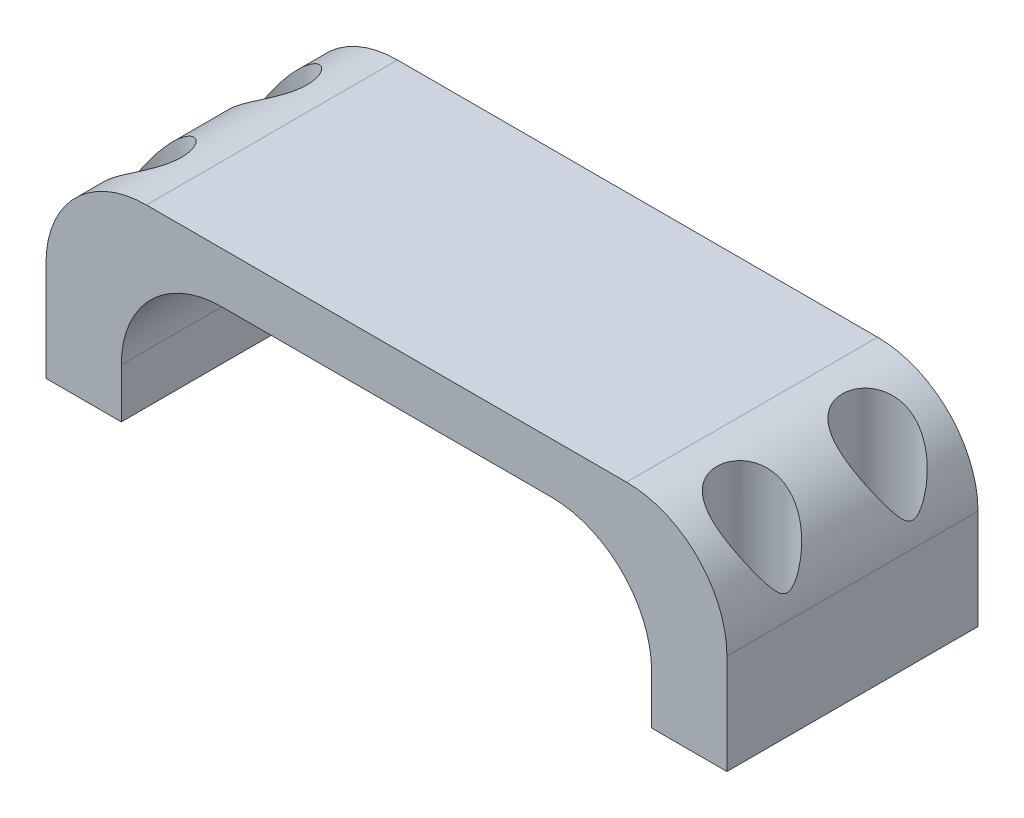
from build123d import *

# Parameters (mm, degrees)
BOSS_EXTRUDE1_DEPTH = 31.75
SKETCH2_R           = 3.175
CUT_EXTRUDE1_DEPTH  = 37.084
SKETCH3_R           = 4.445
CUT_EXTRUDE2_DEPTH  = 37.084


with BuildPart() as part:
    # Sketch1 → Boss-Extrude1 (new body)
    with BuildSketch(Plane.XY):
        with BuildLine():
            Line((-58.273322186, -9.297932879), (-58.273322186, -3.041379021))
            ThreePointArc((-58.273322186, -3.041379021), (-54.553578308, 5.9388771), (-45.573322186, 9.658620979))
            Line((-45.573322186, 9.658620979), (-3.917322186, 9.658620979))
            ThreePointArc((-3.917322186, 9.658620979), (5.062933935, 5.9388771), (8.782677814, -3.041379021))
            Line((8.782677814, -3.041379021), (8.782677814, -9.297932879))
            Line((8.782677814, -9.297932879), (18.307677814, -9.297932879))
            Line((18.307677814, -9.297932879), (18.307677814, 3.346975696))
            ThreePointArc((18.307677814, 3.346975696), (14.587933935, 12.327231817), (5.607677814, 16.046975696))
            Line((5.607677814, 16.046975696), (-55.098322186, 16.046975696))
            ThreePointArc((-55.098322186, 16.046975696), (-64.078578308, 12.327231817), (-67.798322186, 3.346975696))
            Line((-67.798322186, 3.346975696), (-67.798322186, -9.297932879))
            Line((-67.798322186, -9.297932879), (-58.273322186, -9.297932879))
        make_face()
    extrude(amount=BOSS_EXTRUDE1_DEPTH)

    # Sketch2 → Cut-Extrude1 (cut)
    with BuildSketch(Plane.XZ.offset(9.297932879)):
        with Locations(Location((-63.035822186, 7.9375, 0), (0, 0, 270))):
            Circle(SKETCH2_R)
        with Locations(Location((-63.035822186, 23.8125, 0), (0, 0, 270))):
            Circle(SKETCH2_R)
        with Locations(Location((13.545177814, 23.8125, 0), (0, 0, 270))):
            Circle(SKETCH2_R)
        with Locations(Location((13.545177814, 7.9375, 0), (0, 0, 270))):
            Circle(SKETCH2_R)
    extrude(amount=-CUT_EXTRUDE1_DEPTH, mode=Mode.SUBTRACT)

    # Sketch3 → Cut-Extrude2 (cut)
    with BuildSketch(Plane(origin=(0, -2.947932879, 0), x_dir=(-1, 0, 0), z_dir=(0, -1, 0))):
        with Locations(Location((-13.545177814, -23.8125, 0), (0, 0, 90))):
            Circle(SKETCH3_R)
        with Locations(Location((-13.545177814, -7.9375, 0), (0, 0, 90))):
            Circle(SKETCH3_R)
        with Locations(Location((63.035822186, -23.8125, 0), (0, 0, 90))):
            Circle(SKETCH3_R)
        with Locations(Location((63.035822186, -7.9375, 0), (0, 0, 90))):
            Circle(SKETCH3_R)
    extrude(amount=-CUT_EXTRUDE2_DEPTH, mode=Mode.SUBTRACT)


solid = part.part
